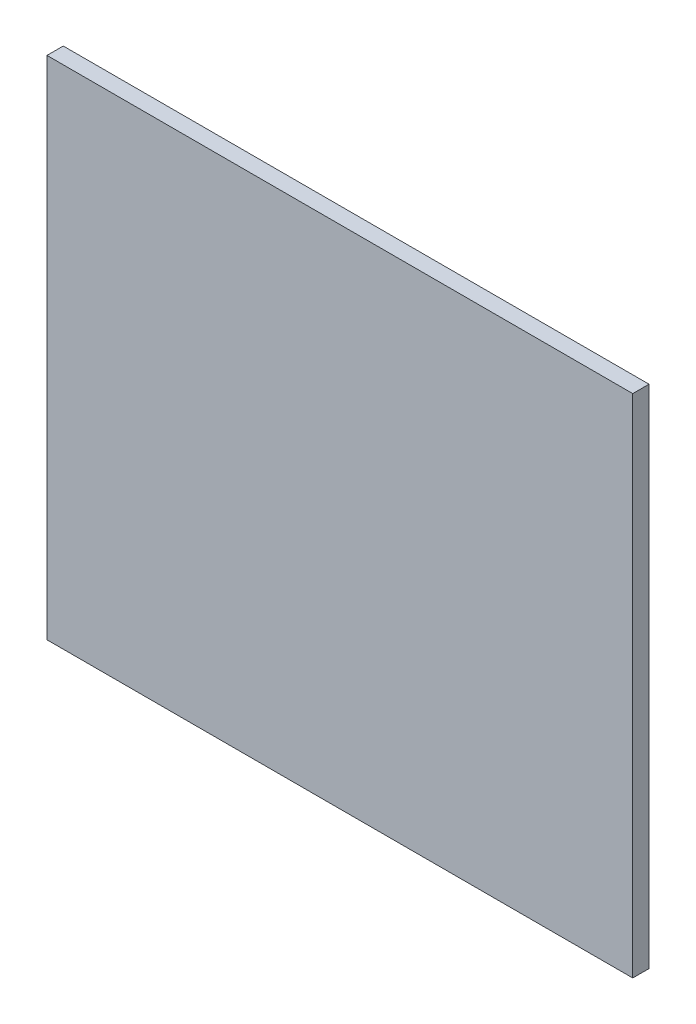
from build123d import *

# Parameters (mm, degrees)
SKETCH_1_W      = 71.999931263
SKETCH_1_H      = 62.210232518
EXTRUDE_1_DEPTH = 2


with BuildPart() as part:
    # Эскиз1 → Вытянуть1 (new body)
    with BuildSketch(Plane.XY):
        with Locations((35.999965632, -31.105116259)):
            Rectangle(SKETCH_1_W, SKETCH_1_H)
    extrude(amount=EXTRUDE_1_DEPTH)


solid = part.part
